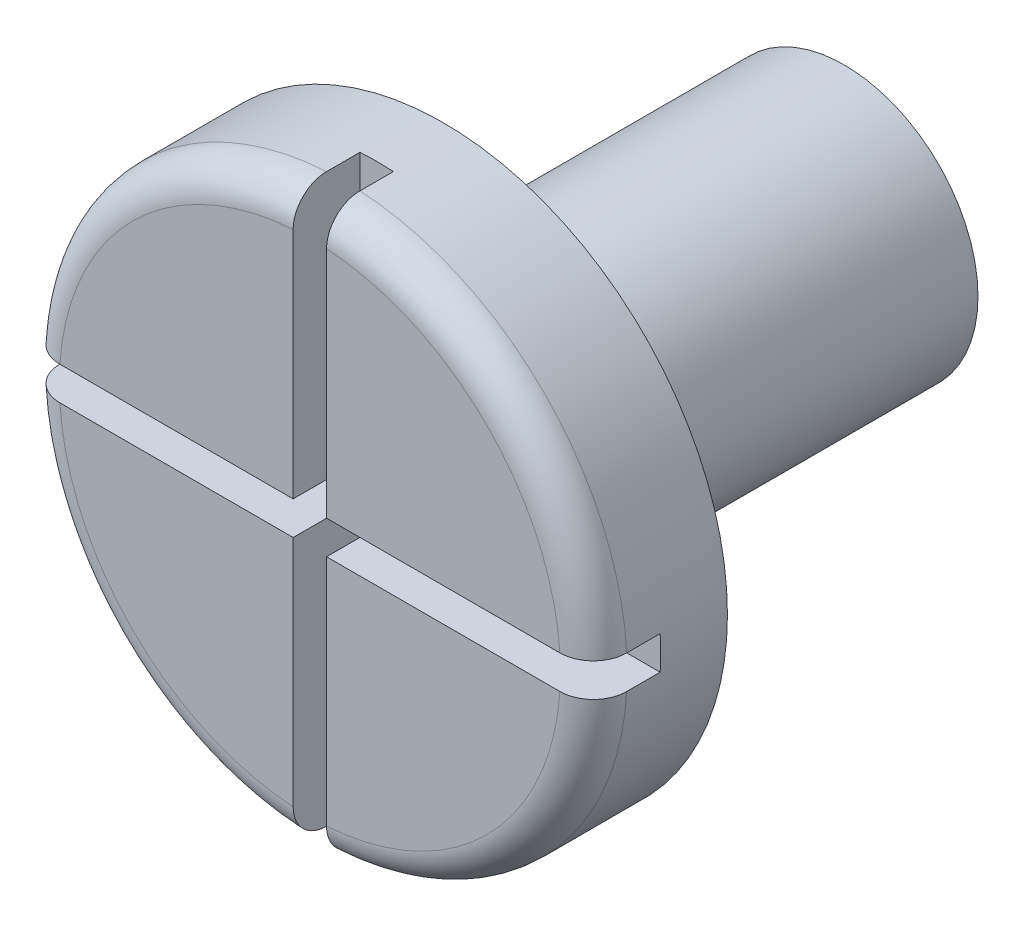
from build123d import *

# Parameters (mm, degrees)
SKETCH1_R           = 4.25
BOSS_EXTRUDE1_DEPTH = 2
SKETCH2_R           = 2
BOSS_EXTRUDE2_DEPTH = 6
CUT_EXTRUDE1_DEPTH  = 1
FILLET1_R           = 0.5


with BuildPart() as part:
    # Sketch1 → Boss-Extrude1 (new body)
    with BuildSketch(Plane.XY):
        Circle(SKETCH1_R)
    extrude(amount=-BOSS_EXTRUDE1_DEPTH)

    # Sketch2 → Boss-Extrude2 (add)
    with BuildSketch(Plane(origin=(0, 0, -2), x_dir=(-1, 0, 0), z_dir=(0, 0, -1))):
        with Locations(Location((0, 0, 0), (0, 0, 180))):
            Circle(SKETCH2_R)
    extrude(amount=BOSS_EXTRUDE2_DEPTH)

    # Sketch3 → Cut-Extrude1 (cut)
    with BuildSketch(Plane.XY):
        Polygon((-4.25, -0.25), (-0.25, -0.25), (-0.25, -4.25), (0.125, -4.817995393), (0.25, -4.25), (0.25, -0.25), (4.25, -0.25), (4.809434234, 0), (4.25, 0.25), (0.25, 0.25), (0.25, 4.25), (0, 4.809434234), (-0.25, 4.25), (-0.25, 0.25), (-4.25, 0.25), (-4.9274721, -0.052748768), align=None)
    extrude(amount=-CUT_EXTRUDE1_DEPTH, mode=Mode.SUBTRACT)

    # Fillet1
    fillet1_edges = [part.edges().sort_by_distance(p)[0] for p in [
        (-3.00520382, 3.00520382, 0),
        (-3.00520382, -3.00520382, 0),
        (3.00520382, -3.00520382, 0),
        (3.00520382, 3.00520382, 0),
    ]]
    fillet(fillet1_edges, radius=FILLET1_R)


solid = part.part
